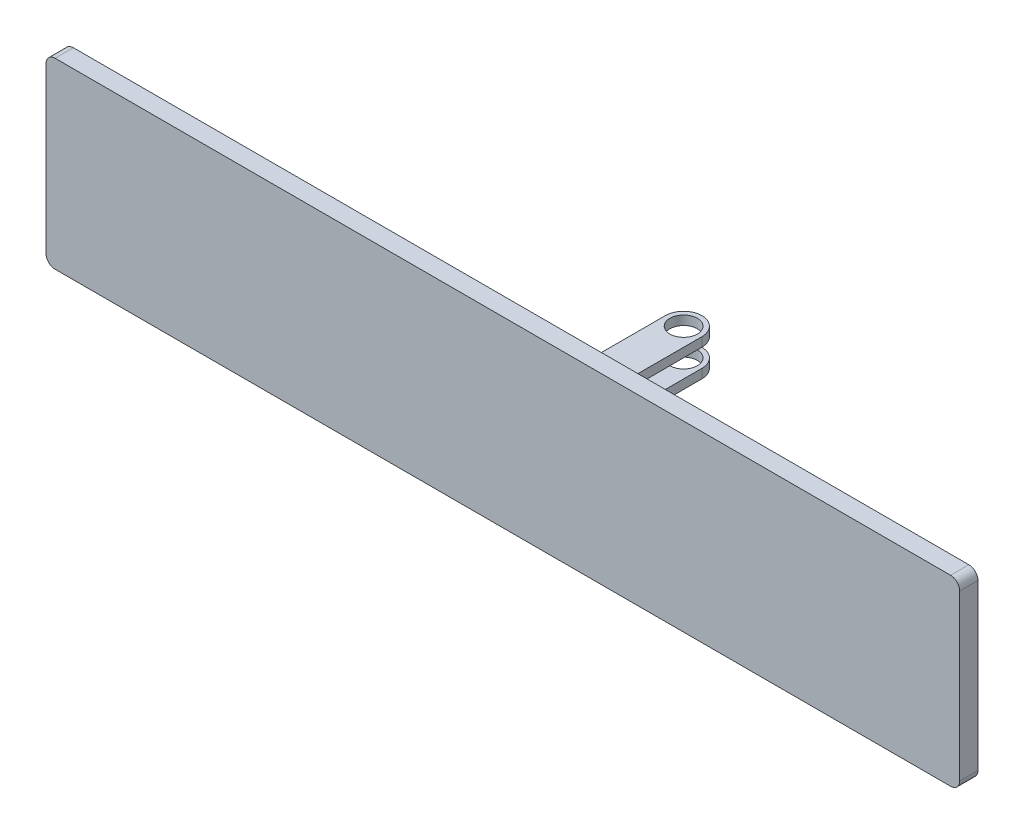
from build123d import *

# Parameters (mm, degrees)
SKETCH1_W           = 100
SKETCH1_H           = 20
BOSS_EXTRUDE1_DEPTH = 2
FILLET6_R           = 1
FILLET7_R           = 1
FILLET8_R           = 1
FILLET9_R           = 1
BOSS_EXTRUDE2_DEPTH = 1
BOSS_EXTRUDE3_START = 1
BOSS_EXTRUDE3_DEPTH = 1
SKETCH4_R           = 1.5
CUT_EXTRUDE4_DEPTH  = 11


with BuildPart() as part:
    # Sketch1 → Boss-Extrude1 (new body)
    with BuildSketch(Plane.XY):
        with Locations((4.951011889, -6.24877109)):
            Rectangle(SKETCH1_W, SKETCH1_H)
    extrude(amount=BOSS_EXTRUDE1_DEPTH)

    # Fillet6
    fillet6_edges = [part.edges().sort_by_distance(p)[0] for p in [
        (54.951011889, -16.24877109, 1),
    ]]
    fillet(fillet6_edges, radius=FILLET6_R)

    # Fillet7
    fillet7_edges = [part.edges().sort_by_distance(p)[0] for p in [
        (-45.048988111, -16.24877109, 1),
    ]]
    fillet(fillet7_edges, radius=FILLET7_R)

    # Fillet8
    fillet8_edges = [part.edges().sort_by_distance(p)[0] for p in [
        (-45.048988111, 3.75122891, 1),
    ]]
    fillet(fillet8_edges, radius=FILLET8_R)

    # Fillet9
    fillet9_edges = [part.edges().sort_by_distance(p)[0] for p in [
        (54.951011889, 3.75122891, 1),
    ]]
    fillet(fillet9_edges, radius=FILLET9_R)

    # Sketch2 → Boss-Extrude2 (add)
    with BuildSketch(Plane(origin=(0, -7.24877109, 0), x_dir=(-1, 0, 0), z_dir=(0, -1, 0))):
        with BuildLine():
            Line((-9.730976741, 0), (-9.730976741, 15))
            ThreePointArc((-9.730976741, 15), (-7.730976741, 17), (-5.730976741, 15))
            Line((-5.730976741, 15), (-5.730976741, 0))
            Line((-5.730976741, 0), (-9.730976741, 0))
        make_face()
    extrude(amount=BOSS_EXTRUDE2_DEPTH)

    # Sketch3 → Boss-Extrude3 (add)
    with BuildSketch(Plane(origin=(0, -5.24877109, 0), x_dir=(1, 0, 0), z_dir=(0, 1, 0)).offset(BOSS_EXTRUDE3_START)):
        with BuildLine():
            Line((5.730976741, 0), (5.730976741, 15))
            ThreePointArc((5.730976741, 15), (7.730976741, 17), (9.730976741, 15))
            Line((9.730976741, 15), (9.730976741, 0))
            Line((9.730976741, 0), (5.730976741, 0))
        make_face()
    extrude(amount=-BOSS_EXTRUDE3_DEPTH)

    # Sketch4 → Cut-Extrude4 (cut)
    with BuildSketch(Plane(origin=(0, -4.24877109, 0), x_dir=(1, 0, 0), z_dir=(0, 1, 0))):
        with Locations(Location((7.730976741, 15, 0), (0, 0, 270))):
            Circle(SKETCH4_R)
        with Locations(Location((7.730976741, 5, 0), (0, 0, 270))):
            Circle(SKETCH4_R)
    extrude(amount=-CUT_EXTRUDE4_DEPTH, mode=Mode.SUBTRACT)


solid = part.part
